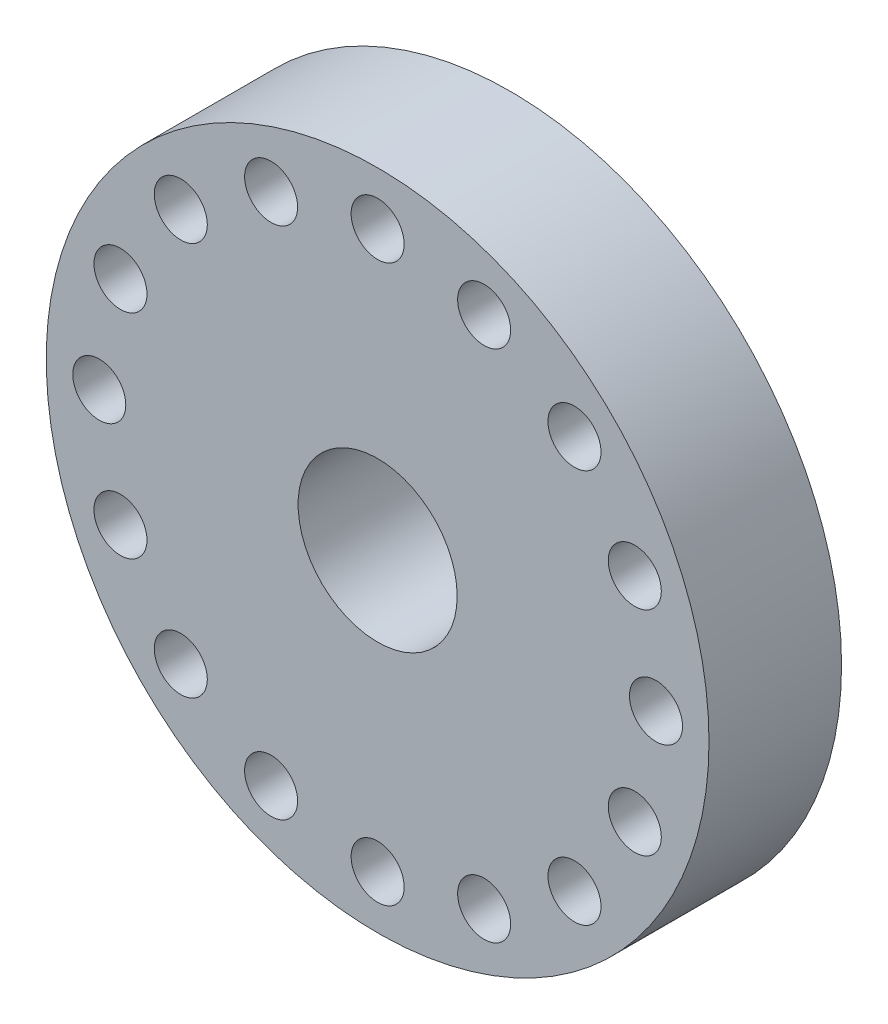
from build123d import *

# Parameters (mm, degrees)
SKETCH2_R           = 50
SKETCH2_R_2         = 12
SKETCH2_R_3         = 4
BOSS_EXTRUDE1_DEPTH = 20


with BuildPart() as part:
    # Sketch2 → Boss-Extrude1 (new body)
    with BuildSketch(Plane(origin=(0, 0, 0), x_dir=(0, 1, 0), z_dir=(0, 0, 1))):
        with Locations(Location((0, 0, 0), (0, 0, 270))):
            Circle(SKETCH2_R)
        with Locations(Location((0, 0, 0), (0, 0, 270))):
            Circle(SKETCH2_R_2, mode=Mode.SUBTRACT)
        with Locations(Location((0, 42, 0), (0, 0, 270))):
            Circle(SKETCH2_R_3, mode=Mode.SUBTRACT)
        with Locations(Location((29.69848481, 29.69848481, 0), (0, 0, 270))):
            Circle(SKETCH2_R_3, mode=Mode.SUBTRACT)
        with Locations(Location((42, 0, 0), (0, 0, 270))):
            Circle(SKETCH2_R_3, mode=Mode.SUBTRACT)
        with Locations(Location((29.69848481, -29.69848481, 0), (0, 0, 270))):
            Circle(SKETCH2_R_3, mode=Mode.SUBTRACT)
        with Locations(Location((0, -42, 0), (0, 0, 270))):
            Circle(SKETCH2_R_3, mode=Mode.SUBTRACT)
        with Locations(Location((-29.69848481, -29.69848481, 0), (0, 0, 270))):
            Circle(SKETCH2_R_3, mode=Mode.SUBTRACT)
        with Locations(Location((-42, 0, 0), (0, 0, 270))):
            Circle(SKETCH2_R_3, mode=Mode.SUBTRACT)
        with Locations(Location((-29.69848481, 29.69848481, 0), (0, 0, 270))):
            Circle(SKETCH2_R_3, mode=Mode.SUBTRACT)
        with Locations(Location((-38.802940365, 16.072704159, 0), (0, 0, 270))):
            Circle(SKETCH2_R_3, mode=Mode.SUBTRACT)
        with Locations(Location((-16.072704159, 38.802940365, 0), (0, 0, 270))):
            Circle(SKETCH2_R_3, mode=Mode.SUBTRACT)
        with Locations(Location((16.072704159, 38.802940365, 0), (0, 0, 270))):
            Circle(SKETCH2_R_3, mode=Mode.SUBTRACT)
        with Locations(Location((38.802940365, 16.072704159, 0), (0, 0, 270))):
            Circle(SKETCH2_R_3, mode=Mode.SUBTRACT)
        with Locations(Location((38.802940365, -16.072704159, 0), (0, 0, 270))):
            Circle(SKETCH2_R_3, mode=Mode.SUBTRACT)
        with Locations(Location((16.072704159, -38.802940365, 0), (0, 0, 270))):
            Circle(SKETCH2_R_3, mode=Mode.SUBTRACT)
        with Locations(Location((-16.072704159, -38.802940365, 0), (0, 0, 270))):
            Circle(SKETCH2_R_3, mode=Mode.SUBTRACT)
        with Locations(Location((-38.802940365, -16.072704159, 0), (0, 0, 270))):
            Circle(SKETCH2_R_3, mode=Mode.SUBTRACT)
    extrude(amount=BOSS_EXTRUDE1_DEPTH)


solid = part.part
